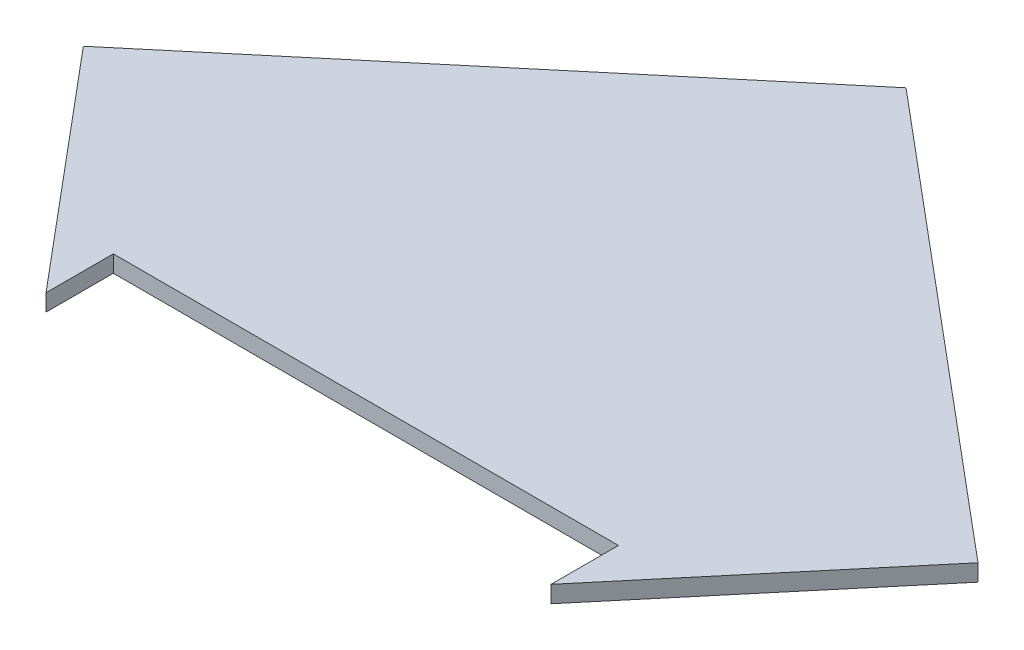
from build123d import *

# Parameters (mm, degrees)
BOSS_EXTRUDE1_DEPTH = 6.35


with BuildPart() as part:
    # Sketch1 → Boss-Extrude1 (new body)
    with BuildSketch(Plane(origin=(0, 0, 0), x_dir=(1, 0, 0), z_dir=(0, 1, 0))):
        Polygon((-95.25, 0), (95.25, 0), (95.25, -25.4), (168.720623787, 62.158879848), (0, 203.73229304), (-168.720623787, 62.158879848), (-95.25, -25.4), align=None)
    extrude(amount=BOSS_EXTRUDE1_DEPTH)


solid = part.part
